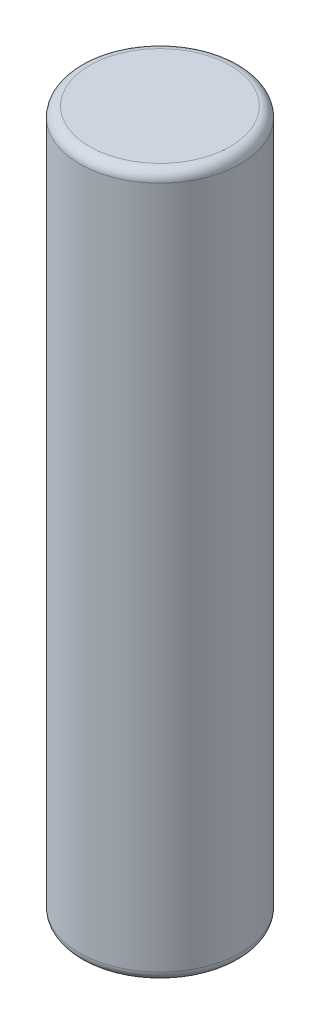
from build123d import *

# Parameters (mm, degrees)
SKETCH2_R           = 0.8
BOSS_EXTRUDE1_DEPTH = 7
FILLET3_R           = 0.1


with BuildPart() as part:
    # Sketch2 → Boss-Extrude1 (new body)
    with BuildSketch(Plane(origin=(0, 0, 0), x_dir=(1, 0, 0), z_dir=(0, 1, 0))):
        with Locations(Location((0, 0, 0), (0, 0, 270))):
            Circle(SKETCH2_R)
    extrude(amount=BOSS_EXTRUDE1_DEPTH)

    # Fillet3
    fillet3_edges = [part.edges().sort_by_distance(p)[0] for p in [
        (0, 0, -0.8),
        (0, 7, -0.8),
    ]]
    fillet(fillet3_edges, radius=FILLET3_R)


solid = part.part
